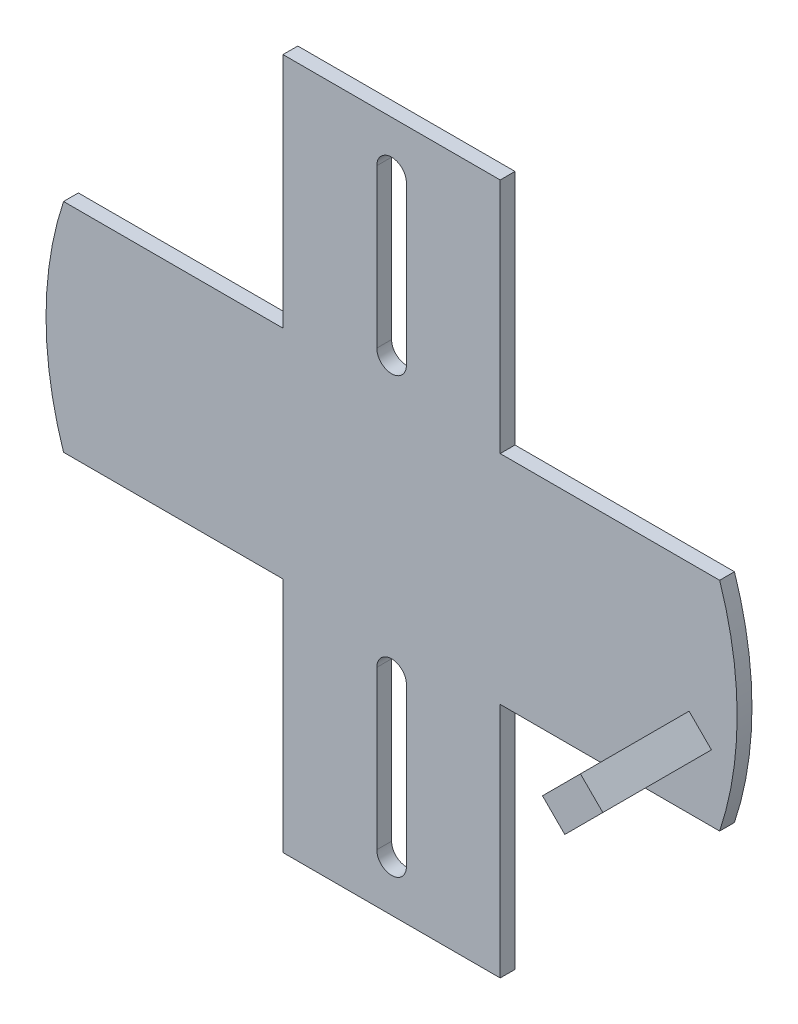
from build123d import *

# Parameters (mm, degrees)
BOSS_EXTRU_1_DEPTH = 1.5
BOSS_EXTRU_2_DEPTH = 11


with BuildPart() as part:
    # Esquisse1 → Boss.-Extru.1 (new body)
    with BuildSketch(Plane.XY):
        with BuildLine():
            Line((-11, 10), (11, 10))
            Line((11, 10), (11, -14))
            Line((11, -14), (33.226495452, -14))
            ThreePointArc((33.226495452, -14), (35, -25), (33.226495452, -36))
            Line((33.226495452, -36), (11, -36))
            Line((11, -36), (11, -60))
            Line((11, -60), (-11, -60))
            Line((-11, -60), (-11, -36))
            Line((-11, -36), (-33.226495452, -36))
            ThreePointArc((-33.226495452, -36), (-35, -25), (-33.226495452, -14))
            Line((-33.226495452, -14), (-11, -14))
            Line((-11, -14), (-11, 10))
        make_face()
        with BuildLine():
            Line((1.5, 5), (1.5, -11))
            ThreePointArc((1.5, -11), (0, -12.5), (-1.5, -11))
            Line((-1.5, -11), (-1.5, 5))
            ThreePointArc((-1.5, 5), (0, 6.5), (1.5, 5))
        make_face(mode=Mode.SUBTRACT)
        with BuildLine():
            Line((1.5, -39), (1.5, -55))
            ThreePointArc((1.5, -55), (0, -56.5), (-1.5, -55))
            Line((-1.5, -55), (-1.5, -39))
            ThreePointArc((-1.5, -39), (0, -37.5), (1.5, -39))
        make_face(mode=Mode.SUBTRACT)
    extrude(amount=BOSS_EXTRU_1_DEPTH)

    # Esquisse3 → Boss.-Extru.2 (add)
    with BuildSketch(Plane.XY.offset(1.5)):
        Polygon((28.544164415, -33.139950571), (32.392821374, -29.291293612), (30.12954231, -27.028014548), (26.280885351, -30.876671507), align=None)
    extrude(amount=BOSS_EXTRU_2_DEPTH)


solid = part.part
